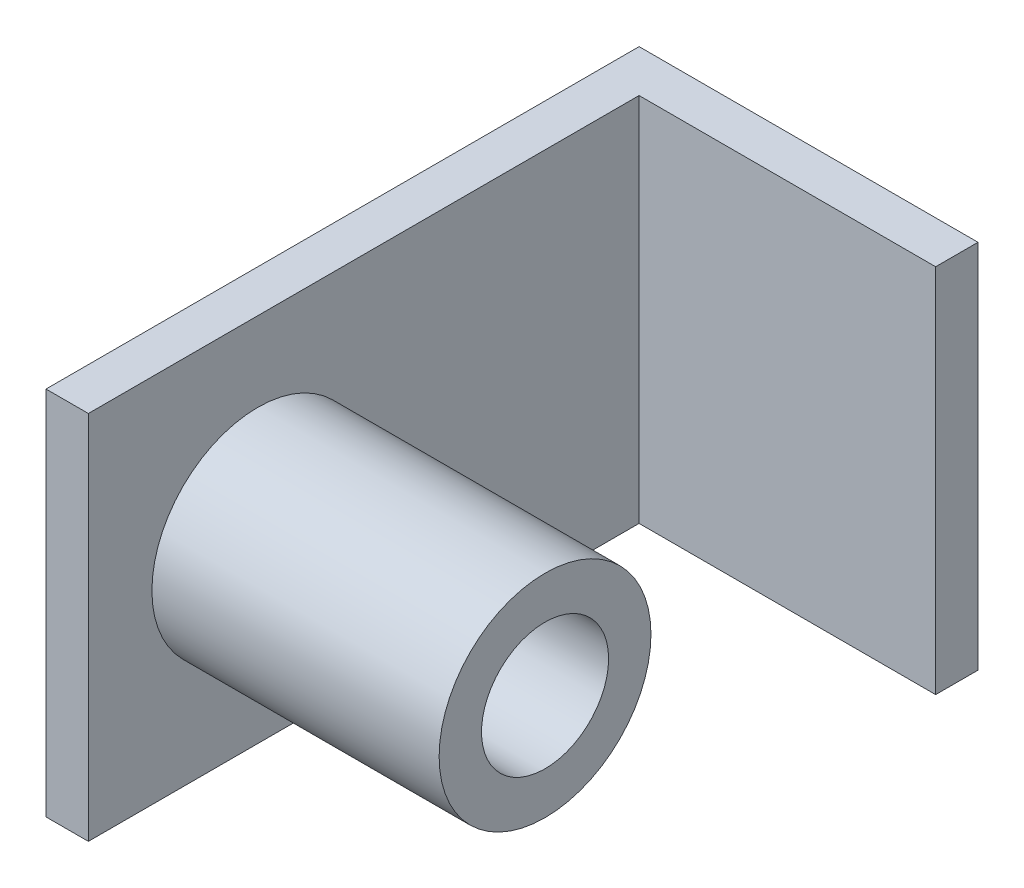
from build123d import *

# Parameters (mm, degrees)
BOSS_EXTRUDE1_DEPTH = 111.092
SKETCH3_R           = 12.7
BOSS_EXTRUDE2_DEPTH = 25.4
SKETCH4_R           = 31.75
SKETCH4_R_2         = 19.05
BOSS_EXTRUDE3_DEPTH = 86.106


with BuildPart() as part:
    # Sketch2 → Boss-Extrude1 (new body)
    with BuildSketch(Plane(origin=(0, 0, 0), x_dir=(1, 0, 0), z_dir=(0, 1, 0))):
        Polygon((101.6, 0), (0, 0), (0, -177.8), (12.7, -177.8), (12.7, -12.7), (101.6, -12.7), align=None)
    extrude(amount=BOSS_EXTRUDE1_DEPTH)

    # Sketch3 → Boss-Extrude2 (add)
    with BuildSketch(Plane(origin=(0, 0, 0), x_dir=(-1, 0, 0), z_dir=(0, 0, -1))):
        with Locations((-50.8, 55.546)):
            Circle(SKETCH3_R)
    extrude(amount=BOSS_EXTRUDE2_DEPTH)

    # Sketch4 → Boss-Extrude3 (add)
    with BuildSketch(Plane(origin=(12.7, 0, 0), x_dir=(0, 0, -1), z_dir=(1, 0, 0))):
        with Locations(Location((-127, 55.546, 0), (0, 0, 180))):
            Circle(SKETCH4_R)
        with Locations((-127, 55.546)):
            Circle(SKETCH4_R_2, mode=Mode.SUBTRACT)
    extrude(amount=BOSS_EXTRUDE3_DEPTH)


solid = part.part
